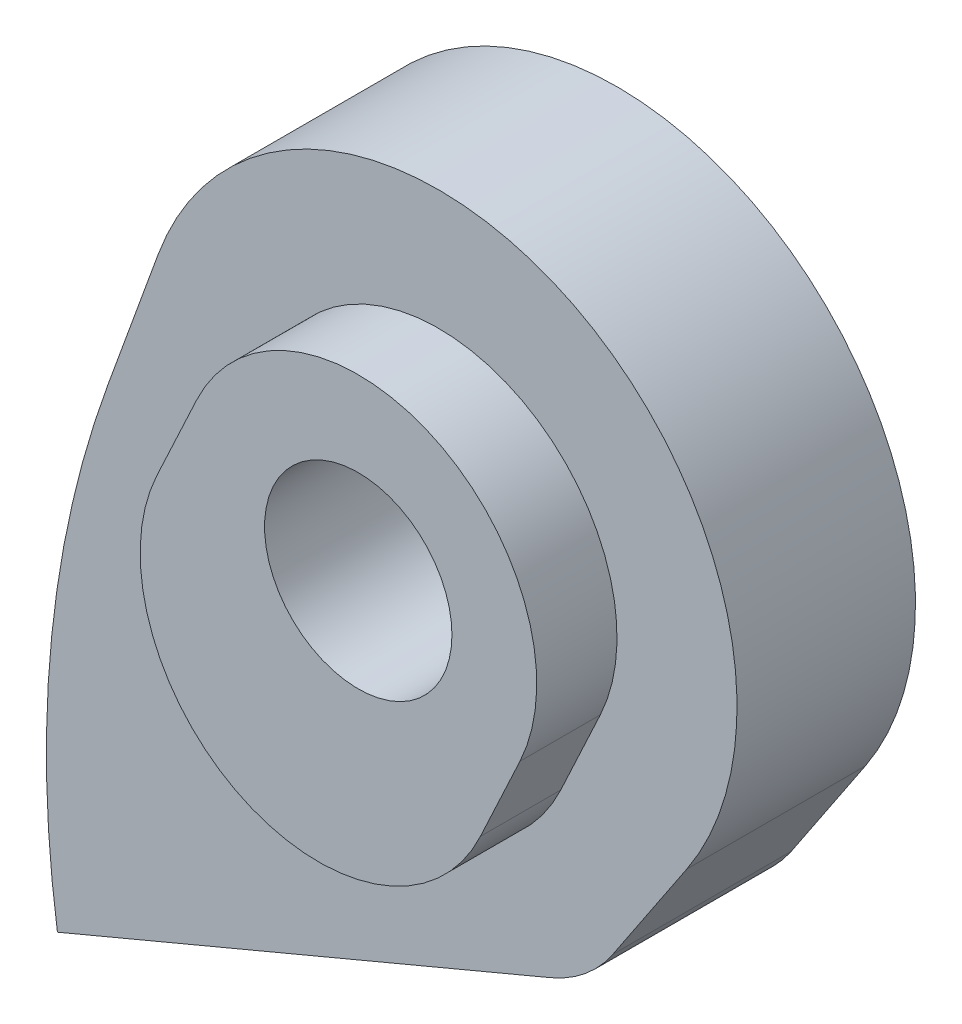
from build123d import *
from build123d.topology import SkipClean

# Parameters (mm, degrees)
SKETCH3_R           = 2.75
SKETCH3_R_2         = 2.1
BOSS_EXTRUDE2_DEPTH = 11
BOSS_EXTRUDE4_START = 4
BOSS_EXTRUDE4_DEPTH = 4
BOSS_EXTRUDE3_START = 3
BOSS_EXTRUDE3_DEPTH = 3
SKETCH14_W          = 47.285712055
SKETCH14_H          = 12.595473758
CUT_EXTRUDE1_DEPTH  = 92.326119258
BOSS_EXTRUDE5_DEPTH = 1.8
SKETCH15_R          = 2.1
CUT_EXTRUDE2_DEPTH  = 88.697437271


with BuildPart() as part:
    # Sketch3 → Boss-Extrude2 (new body)
    with BuildSketch(Plane.XY):
        with BuildLine():
            Line((11.81639044, 60.252883085), (11.728372068, 60.311638564))
            ThreePointArc((11.728372068, 60.311638564), (8.917204522, 62.7925154), (6.866230988, 65.931132995))
            ThreePointArc((6.866230988, 65.931132995), (6.025591445, 67.274340702), (4.901176311, 68.390840765))
            ThreePointArc((4.901176311, 68.390840765), (3.375934297, 70.989881123), (4.020351516, 73.93370524))
            Line((4.020351516, 73.93370524), (5.678869184, 76.41823992))
            ThreePointArc((5.678869184, 76.41823992), (3.137547336, 86.100651278), (-6.171856019, 82.420649156))
            Line((-6.171856019, 82.420649156), (-7.290261888, 79.347854286))
            ThreePointArc((-7.290261888, 79.347854286), (-8.557893098, 69.185727028), (-5.279809822, 59.483671095))
            ThreePointArc((-5.279809822, 59.483671095), (-2.848156457, 57.139360441), (0.414833066, 56.266646336))
            ThreePointArc((0.414833066, 56.266646336), (3.287818882, 55.822166382), (5.91364728, 54.574514525))
            Line((5.91364728, 54.574514525), (7.374782695, 53.599153256))
            ThreePointArc((7.374782695, 53.599153256), (10.815902262, 50.678650143), (13.499590609, 47.049812979))
            ThreePointArc((13.499590609, 47.049812979), (24.965953819, 46.665736496), (20.21385057, 57.108078892))
            ThreePointArc((20.21385057, 57.108078892), (15.833272198, 58.194897845), (11.81639044, 60.252883085))
        make_face()
        with Locations((19.351869275, 50.413343031)):
            Circle(SKETCH3_R, mode=Mode.SUBTRACT)
        with Locations((0.471910886, 63.016405008)):
            Circle(SKETCH3_R, mode=Mode.SUBTRACT)
        with Locations((0.114687614, 80.132534397)):
            Circle(SKETCH3_R_2, mode=Mode.SUBTRACT)
    extrude(amount=BOSS_EXTRUDE2_DEPTH)

    # Sketch13 → Boss-Extrude4 (add)
    with SkipClean():  # the faces are left unmerged after this step: merging them gives an invalid solid
        with BuildSketch(Plane(origin=(0, 0, 0), x_dir=(-1, 0, 0), z_dir=(0, 0, -1)).offset(BOSS_EXTRUDE4_START)):
            with BuildLine():
                Line((-5.678869184, 76.41823992), (-4.020351516, 73.93370524))
                ThreePointArc((-4.020351516, 73.93370524), (-3.407782277, 73.255690271), (-2.625844204, 72.782913134))
                Line((-2.625844204, 72.782913134), (8.427696777, 68.139691908))
                ThreePointArc((8.427696777, 68.139691908), (8.557268078, 73.814637343), (7.290261888, 79.347854286))
                Line((7.290261888, 79.347854286), (6.171856019, 82.420649156))
                ThreePointArc((6.171856019, 82.420649156), (-3.137547336, 86.100651278), (-5.678869184, 76.41823992))
            make_face()
        extrude(amount=-BOSS_EXTRUDE4_DEPTH)

    # Sketch12 → Boss-Extrude3 (add)
    with SkipClean():  # the faces are left unmerged after this step: merging them gives an invalid solid
        with BuildSketch(Plane(origin=(0, 0, -4), x_dir=(-1, 0, 0), z_dir=(0, 0, -1)).offset(BOSS_EXTRUDE3_START)):
            with BuildLine():
                Line((8.013597957, 76.965805827), (4.924247842, 69.611373108))
                Line((4.924247842, 69.611373108), (8.427696777, 68.139691908))
                ThreePointArc((8.427696777, 68.139691908), (8.649339764, 72.572862025), (8.013597957, 76.965805827))
            make_face()
        extrude(amount=-BOSS_EXTRUDE3_DEPTH)

    # Sketch14 → Cut-Extrude1 (cut, through all)
    with BuildSketch(Plane(origin=(0, 0, 0), x_dir=(1, 0, 0), z_dir=(0, 1, 0))):
        with Locations((8.412006537, -6.297736879)):
            Rectangle(SKETCH14_W, SKETCH14_H)
    extrude(amount=CUT_EXTRUDE1_DEPTH, mode=Mode.SUBTRACT)

    # Sketch16 → Boss-Extrude5 (add)
    with BuildSketch(Plane.XY):
        with BuildLine():
            Line((3.739918762, 78.44206135), (2.852420412, 76.538814997))
            ThreePointArc((2.852420412, 76.538814997), (-2.463283783, 74.604056896), (-4.398041884, 79.919761091))
            Line((-4.398041884, 79.919761091), (-3.510543534, 81.823007444))
            ThreePointArc((-3.510543534, 81.823007444), (1.805160661, 83.757765545), (3.739918762, 78.44206135))
        make_face()
    extrude(amount=BOSS_EXTRUDE5_DEPTH)

    # Sketch15 → Cut-Extrude2 (cut, through all)
    with BuildSketch(Plane.XY.offset(1.8)):
        with Locations((0.114687614, 80.132534397)):
            Circle(SKETCH15_R)
    extrude(amount=-CUT_EXTRUDE2_DEPTH, mode=Mode.SUBTRACT)


solid = part.part
